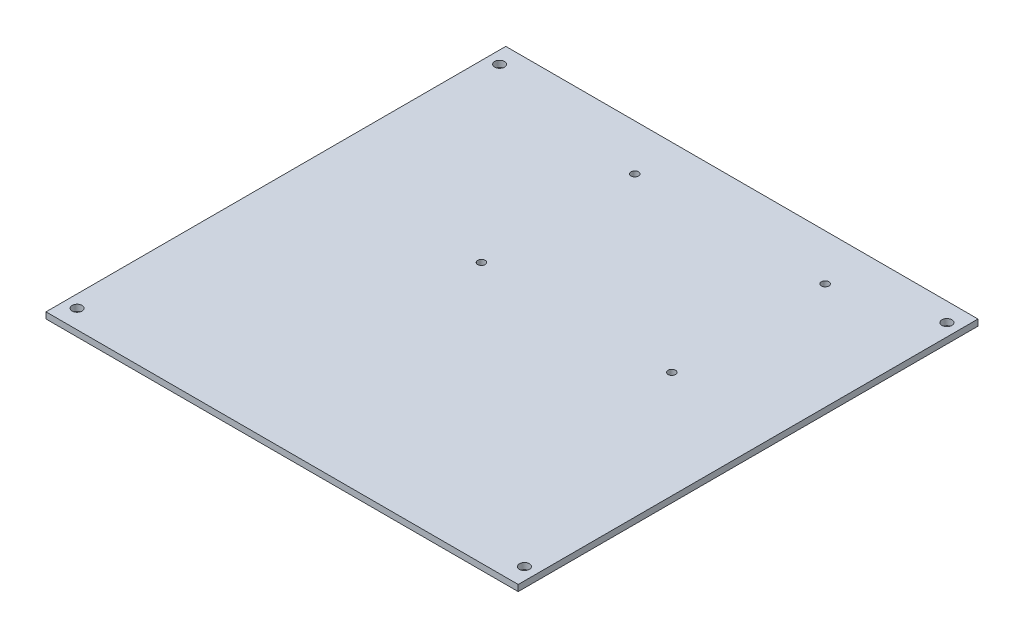
from build123d import *

# Parameters (mm, degrees)
SKETCH1_W           = 190
SKETCH1_H           = 185
BOSS_EXTRUDE1_DEPTH = 2.5
SKETCH3_R           = 2
CUT_EXTRUDE2_DEPTH  = 10
SKETCH4_R           = 1.5
CUT_EXTRUDE3_DEPTH  = 10


with BuildPart() as part:
    # Sketch1 → Boss-Extrude1 (new body)
    with BuildSketch(Plane(origin=(0, 0, 0), x_dir=(1, 0, 0), z_dir=(0, 1, 0))):
        Rectangle(SKETCH1_W, SKETCH1_H)
    extrude(amount=BOSS_EXTRUDE1_DEPTH)

    # Sketch3 → Cut-Extrude2 (cut)
    with BuildSketch(Plane(origin=(0, 2.5, 0), x_dir=(1, 0, 0), z_dir=(0, 1, 0))):
        with Locations(Location((-90, 85, 0), (0, 0, 270))):
            Circle(SKETCH3_R)
        with Locations(Location((-90, -85, 0), (0, 0, 270))):
            Circle(SKETCH3_R)
        with Locations(Location((90, 85, 0), (0, 0, 90))):
            Circle(SKETCH3_R)
        with Locations(Location((90, -85, 0), (0, 0, 90))):
            Circle(SKETCH3_R)
    extrude(amount=-CUT_EXTRUDE2_DEPTH, mode=Mode.SUBTRACT)

    # Sketch4 → Cut-Extrude3 (cut)
    with BuildSketch(Plane(origin=(0, 2.5, 0), x_dir=(1, 0, 0), z_dir=(0, 1, 0))):
        with Locations(Location((52, 74, 0), (0, 0, 270))):
            Circle(SKETCH4_R)
        with Locations(Location((-24.6, 74, 0), (0, 0, 270))):
            Circle(SKETCH4_R)
        with Locations(Location((-24.6, 12.3, 0), (0, 0, 270))):
            Circle(SKETCH4_R)
        with Locations(Location((52, 12.3, 0), (0, 0, 270))):
            Circle(SKETCH4_R)
    extrude(amount=-CUT_EXTRUDE3_DEPTH, mode=Mode.SUBTRACT)


solid = part.part
